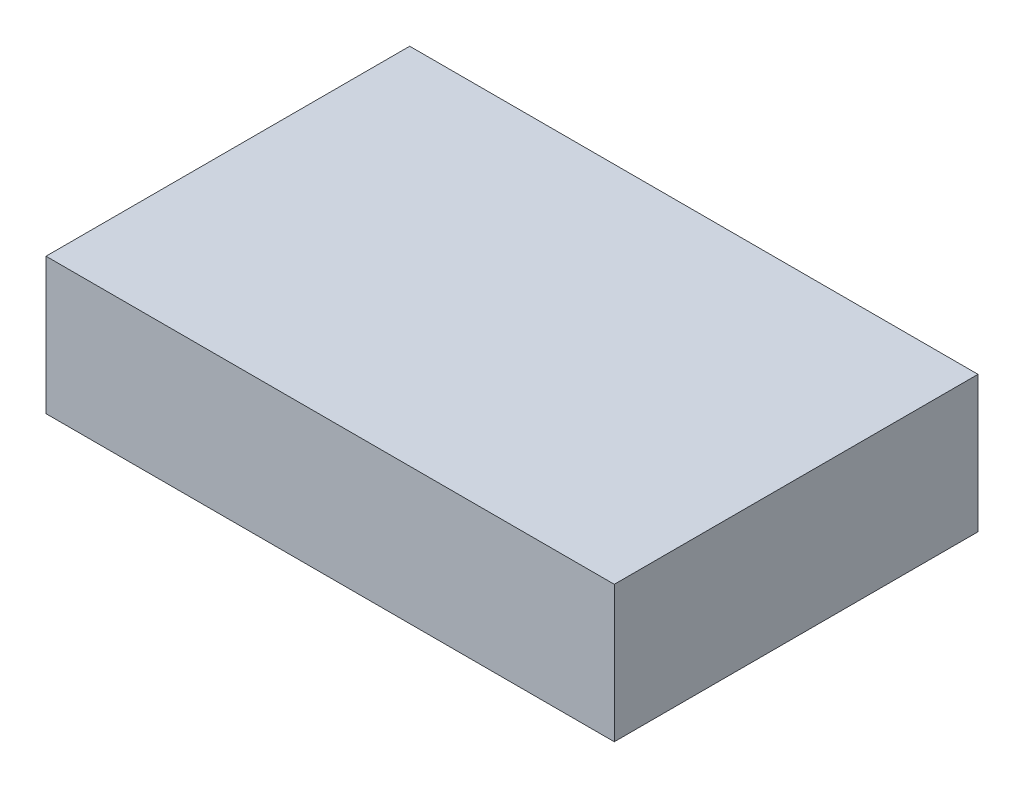
from build123d import *

# Parameters (mm, degrees)
SZKIC1_W                    = 125
SZKIC1_H                    = 80
DODANIE_WYCI_GNI_CIE1_DEPTH = 30
SKORUPA2_T                  = -3


with BuildPart() as part:
    # Szkic1 → Dodanie-wyciągnięcie1 (new body)
    with BuildSketch(Plane(origin=(0, 0, 0), x_dir=(1, 0, 0), z_dir=(0, 1, 0))):
        Rectangle(SZKIC1_W, SZKIC1_H)
    extrude(amount=-DODANIE_WYCI_GNI_CIE1_DEPTH)

    # Skorupa2
    skorupa2_openings = [part.faces().sort_by_distance(p)[0] for p in [
        (0, -30, 0),
    ]]
    offset(amount=SKORUPA2_T, openings=skorupa2_openings, kind=Kind.INTERSECTION)


solid = part.part
